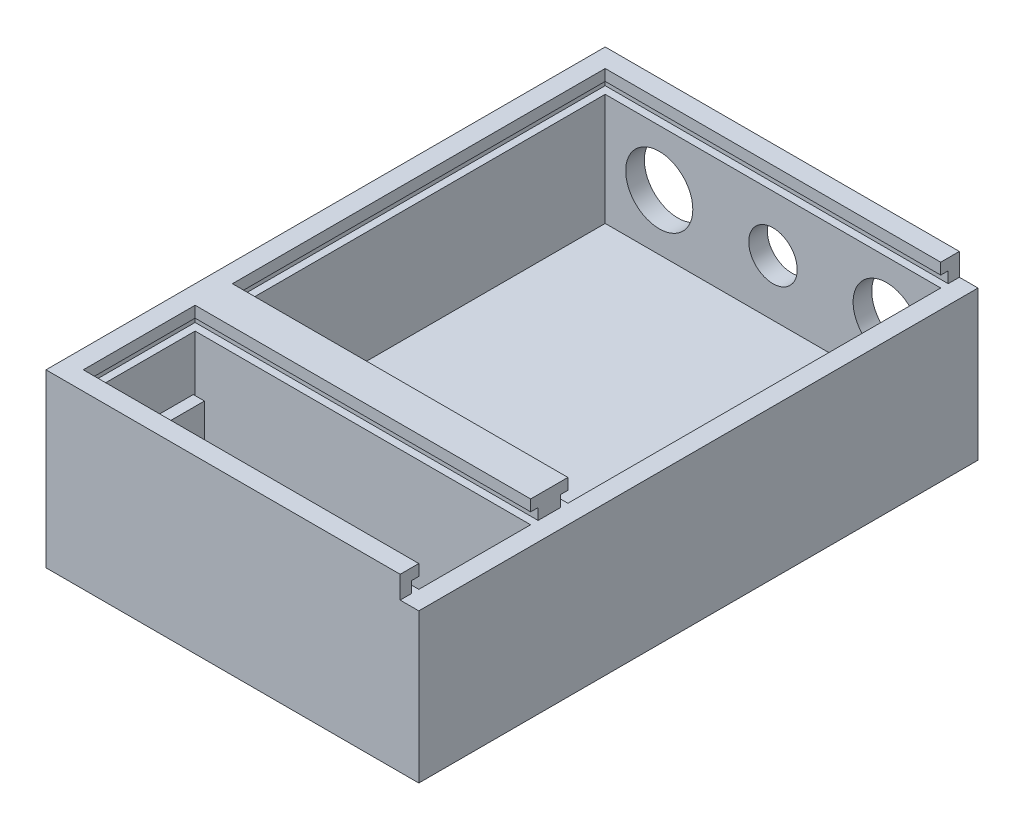
from build123d import *

# Parameters (mm, degrees)
SKETCH1_W            = 100
SKETCH1_H            = 40
BOSS_EXTRUDE1_DEPTH  = 150
SKETCH2_W            = 90
SKETCH2_H            = 140
CUT_EXTRUDE1_DEPTH   = 30
SKETCH5_W            = 90
SKETCH5_H            = 10
BOSS_EXTRUDE3_DEPTH  = 30
BOSS_EXTRUDE6_DEPTH  = 6
BOSS_EXTRUDE7_DEPTH  = 3
BOSS_EXTRUDE8_DEPTH  = 6
CUT_EXTRUDE7_DEPTH   = 3
SKETCH14_W           = 3
SKETCH14_H           = 20
BOSS_EXTRUDE9_DEPTH  = 20
SKETCH15_W           = 3
SKETCH15_H           = 20
BOSS_EXTRUDE10_DEPTH = 20
SKETCH16_W           = 35
SKETCH16_H           = 2
BOSS_EXTRUDE11_DEPTH = 10
SKETCH17_W           = 35
SKETCH17_H           = 2.001720383
BOSS_EXTRUDE12_DEPTH = 10
SKETCH18_R           = 6.5
SKETCH18_R_2         = 9
CUT_EXTRUDE9_DEPTH   = 10


with BuildPart() as part:
    # Sketch1 → Boss-Extrude1 (new body)
    with BuildSketch(Plane.XY):
        with Locations((6.252485089, -6.669980119)):
            Rectangle(SKETCH1_W, SKETCH1_H)
    extrude(amount=BOSS_EXTRUDE1_DEPTH)

    # Sketch2 → Cut-Extrude1 (cut)
    with BuildSketch(Plane(origin=(0, 13.330019881, 0), x_dir=(1, 0, 0), z_dir=(0, 1, 0))):
        with Locations((6.252485089, -75)):
            Rectangle(SKETCH2_W, SKETCH2_H)
    extrude(amount=-CUT_EXTRUDE1_DEPTH, mode=Mode.SUBTRACT)

    # Sketch5 → Boss-Extrude3 (add)
    with BuildSketch(Plane(origin=(0, 13.330019881, 0), x_dir=(1, 0, 0), z_dir=(0, 1, 0))):
        with Locations((6.252485089, -110)):
            Rectangle(SKETCH5_W, SKETCH5_H)
    extrude(amount=-BOSS_EXTRUDE3_DEPTH)

    # Sketch8 → Boss-Extrude6 (add)
    with BuildSketch(Plane(origin=(0, 13.330019881, 0), x_dir=(1, 0, 0), z_dir=(0, 1, 0))):
        Polygon((-43.747514911, -113), (-43.747514911, -150), (-40.747514911, -150), (51.252485089, -150), (51.252485089, -147), (-40.747514911, -147), (-40.747514911, -113), (51.252485089, -113), (51.252485089, -110), (-43.747514911, -110), align=None)
    extrude(amount=BOSS_EXTRUDE6_DEPTH)

    # Sketch10 → Boss-Extrude7 (add)
    with BuildSketch(Plane(origin=(0, 19.330019881, 0), x_dir=(1, 0, 0), z_dir=(0, 1, 0))):
        Polygon((51.252485089, -113), (51.252485089, -115), (-38.747514911, -115), (-38.747514911, -145), (51.252485089, -145), (51.252485089, -147), (-40.747514911, -147), (-40.747514911, -113), align=None)
    extrude(amount=-BOSS_EXTRUDE7_DEPTH)

    # Sketch11 → Boss-Extrude8 (add)
    with BuildSketch(Plane(origin=(0, 19.330019881, 0), x_dir=(1, 0, 0), z_dir=(0, 1, 0))):
        Polygon((51.252485089, -110), (51.252485089, -105), (-38.747514911, -105), (-38.747514911, -5), (51.252485089, -5), (51.252485089, 0), (-43.747514911, 0), (-43.747514911, -110), align=None)
    extrude(amount=-BOSS_EXTRUDE8_DEPTH)

    # Sketch13 → Cut-Extrude7 (cut)
    with BuildSketch(Plane(origin=(0, 13.330019881, 0), x_dir=(1, 0, 0), z_dir=(0, 1, 0))):
        Polygon((51.252485089, -3), (-40.747514911, -3), (-40.747514911, -107), (51.252485089, -107), (51.252485089, -105), (-38.747514911, -105), (-38.747514911, -5), (51.252485089, -5), align=None)
    extrude(amount=CUT_EXTRUDE7_DEPTH, mode=Mode.SUBTRACT)

    # Sketch14 → Boss-Extrude9 (add)
    with BuildSketch(Plane(origin=(0, -16.669980119, 0), x_dir=(1, 0, 0), z_dir=(0, 1, 0))):
        with Locations((-32.747514911, -130)):
            Rectangle(SKETCH14_W, SKETCH14_H)
    extrude(amount=BOSS_EXTRUDE9_DEPTH)

    # Sketch15 → Boss-Extrude10 (add)
    with BuildSketch(Plane(origin=(0, -16.669980119, 0), x_dir=(1, 0, 0), z_dir=(0, 1, 0))):
        with Locations((45.252485089, -130)):
            Rectangle(SKETCH15_W, SKETCH15_H)
    extrude(amount=BOSS_EXTRUDE10_DEPTH)

    # Sketch16 → Boss-Extrude11 (add)
    with BuildSketch(Plane(origin=(0, -16.669980119, 0), x_dir=(1, 0, 0), z_dir=(0, 1, 0))):
        with Locations((6.252485089, -121)):
            Rectangle(SKETCH16_W, SKETCH16_H)
    extrude(amount=BOSS_EXTRUDE11_DEPTH)

    # Sketch17 → Boss-Extrude12 (add)
    with BuildSketch(Plane(origin=(0, -16.669980119, 0), x_dir=(1, 0, 0), z_dir=(0, 1, 0))):
        with Locations((6.252485089, -138.999139808)):
            Rectangle(SKETCH17_W, SKETCH17_H)
    extrude(amount=BOSS_EXTRUDE12_DEPTH)

    # Sketch18 → Cut-Extrude9 (cut)
    with BuildSketch(Plane.XY):
        with Locations((6.252485089, -1.669980119)):
            Circle(SKETCH18_R)
        with Locations((36.752485089, -1.669980119)):
            Circle(SKETCH18_R_2)
        with Locations((-24.247514911, -1.669980119)):
            Circle(SKETCH18_R_2)
    extrude(amount=CUT_EXTRUDE9_DEPTH, mode=Mode.SUBTRACT)


solid = part.part
